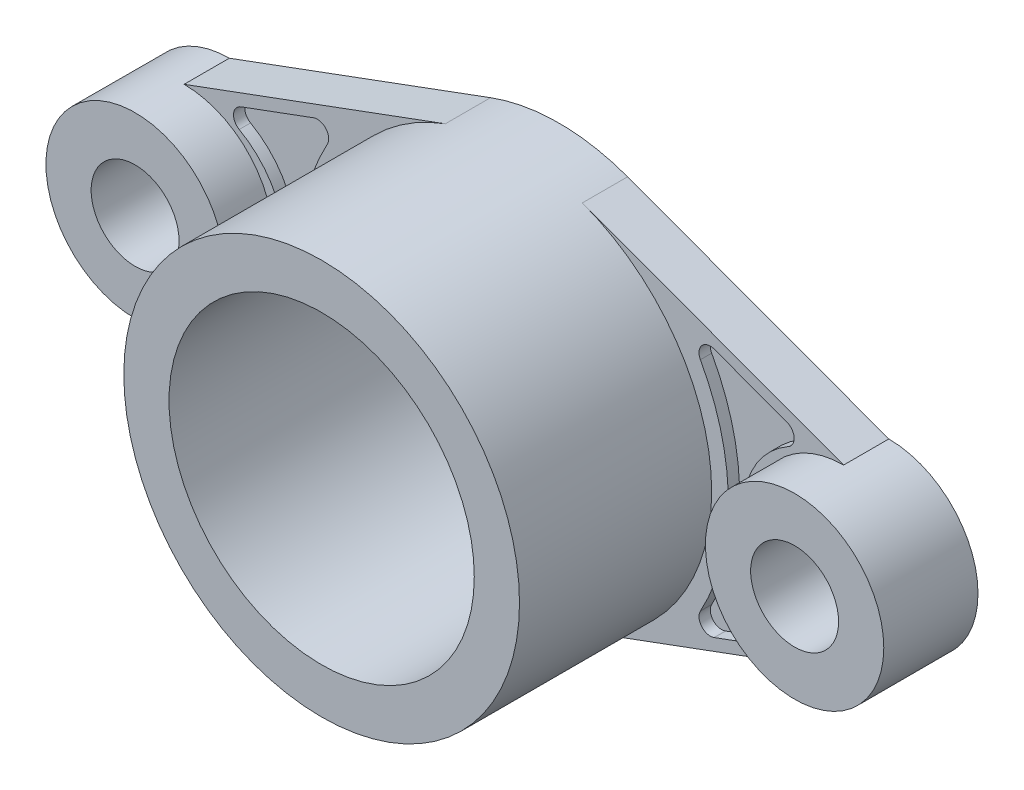
from build123d import *

# Parameters (mm, degrees)
SHAFT_MOUNT_SKETCH_R           = 52.5
SHAFT_MOUNT_SKETCH_R_2         = 40.5
CYLINDRICAL_BORE_EXTRUDE_DEPTH = 63
SKETCH1_3_R                    = 23.665
SKETCH1_3_R_2                  = 11.665
BOLT_HOLES_EXTRUDE_DEPTH       = 25
BOLT_HOLES_EXTRUDE_2_DEPTH     = 25
SHAFT_MOUNT_GUSSETS_DEPTH      = 12
FLANGE_START                   = 12
FLANGE_EXTRUDED_CUT_1_DEPTH    = 3
FLANGE_EXTRUDED_CUT_2_DEPTH    = 3


with BuildPart() as part:
    # Shaft Mount Sketch → Cylindrical Bore Extrude (new body)
    with BuildSketch(Plane.XY):
        Circle(SHAFT_MOUNT_SKETCH_R)
        Circle(SHAFT_MOUNT_SKETCH_R_2, mode=Mode.SUBTRACT)
    extrude(amount=CYLINDRICAL_BORE_EXTRUDE_DEPTH)



with BuildPart() as body_2:
    # Sketch1<3> → Bolt Holes Extrude (new body)
    with BuildSketch(Plane.XY):
        with Locations((-87.5, 0)):
            Circle(SKETCH1_3_R)
        with Locations((-87.5, 0)):
            Circle(SKETCH1_3_R_2, mode=Mode.SUBTRACT)
    extrude(amount=BOLT_HOLES_EXTRUDE_DEPTH)


with BuildPart() as body_3:
    # Sketch1<3> → Bolt Holes Extrude 2 (new body)
    with BuildSketch(Plane.XY):
        with Locations((87.5, 0)):
            Circle(SKETCH1_3_R)
        with Locations((87.5, 0)):
            Circle(SKETCH1_3_R_2, mode=Mode.SUBTRACT)
    extrude(amount=BOLT_HOLES_EXTRUDE_2_DEPTH)


with BuildPart() as part_1:
    add(part.part)

    add(body_2.part)  # Shaft Mount Gussets merges body 2

    add(body_3.part)  # Shaft Mount Gussets merges body 3
    # Sketch1<4> → Shaft Mount Gussets (add)
    with BuildSketch(Plane.XY):
        with BuildLine():
            Line((-18.179450038, 49.251980634), (-87.5, 23.665))
            ThreePointArc((-87.5, 23.665), (-63.835, 0), (-87.5, -23.665))
            Line((-87.5, -23.665), (-18.179450038, -49.251980634))
            ThreePointArc((-18.179450038, -49.251980634), (-52.5, 0), (-18.179450038, 49.251980634))
        make_face()
        with BuildLine():
            Line((87.5, 23.665), (18.179450038, 49.251980634))
            ThreePointArc((18.179450038, 49.251980634), (52.5, 0), (18.179450038, -49.251980634))
            Line((18.179450038, -49.251980634), (87.5, -23.665))
            ThreePointArc((87.5, -23.665), (63.835, 0), (87.5, 23.665))
        make_face()
    extrude(amount=SHAFT_MOUNT_GUSSETS_DEPTH)

    # Socket Sketch<6> → Flange Extruded Cut 1 (cut)
    with BuildSketch(Plane.XY.offset(FLANGE_START)):
        with BuildLine():
            ThreePointArc((53.167380744, -33.139708031), (49.854923731, -32.28250119), (49.5, -28.879384358))
            ThreePointArc((49.5, -28.879384358), (56.918852132, 0), (49.5, 28.879384358))
            ThreePointArc((49.5, 28.879384358), (49.854923731, 32.28250119), (53.167380744, 33.139708031))
            Line((53.167380744, 33.139708031), (72.424639318, 26.031641195))
            ThreePointArc((72.424639318, 26.031641195), (74.376149951, 23.457842629), (72.861251786, 20.605139287))
            ThreePointArc((72.861251786, 20.605139287), (60.835, 0), (72.861251786, -20.605139287))
            ThreePointArc((72.861251786, -20.605139287), (74.376149951, -23.457842629), (72.424639318, -26.031641195))
            Line((72.424639318, -26.031641195), (53.167380744, -33.139708031))
        make_face()
    extrude(amount=-FLANGE_EXTRUDED_CUT_1_DEPTH, mode=Mode.SUBTRACT)

    # Socket Sketch<7> → Flange Extruded Cut 2 (cut)
    with BuildSketch(Plane.XY.offset(FLANGE_START)):
        with BuildLine():
            ThreePointArc((-49.5, 28.879384358), (-56.918852132, 0), (-49.5, -28.879384358))
            ThreePointArc((-49.5, -28.879384358), (-49.854923731, -32.28250119), (-53.167380744, -33.139708031))
            Line((-53.167380744, -33.139708031), (-72.424639318, -26.031641195))
            ThreePointArc((-72.424639318, -26.031641195), (-74.376149951, -23.457842629), (-72.861251786, -20.605139287))
            ThreePointArc((-72.861251786, -20.605139287), (-60.835, 0), (-72.861251786, 20.605139287))
            ThreePointArc((-72.861251786, 20.605139287), (-74.376149951, 23.457842629), (-72.424639318, 26.031641195))
            Line((-72.424639318, 26.031641195), (-53.167380744, 33.139708031))
            ThreePointArc((-53.167380744, 33.139708031), (-49.854923731, 32.28250119), (-49.5, 28.879384358))
        make_face()
    extrude(amount=-FLANGE_EXTRUDED_CUT_2_DEPTH, mode=Mode.SUBTRACT)


solid = part_1.part
